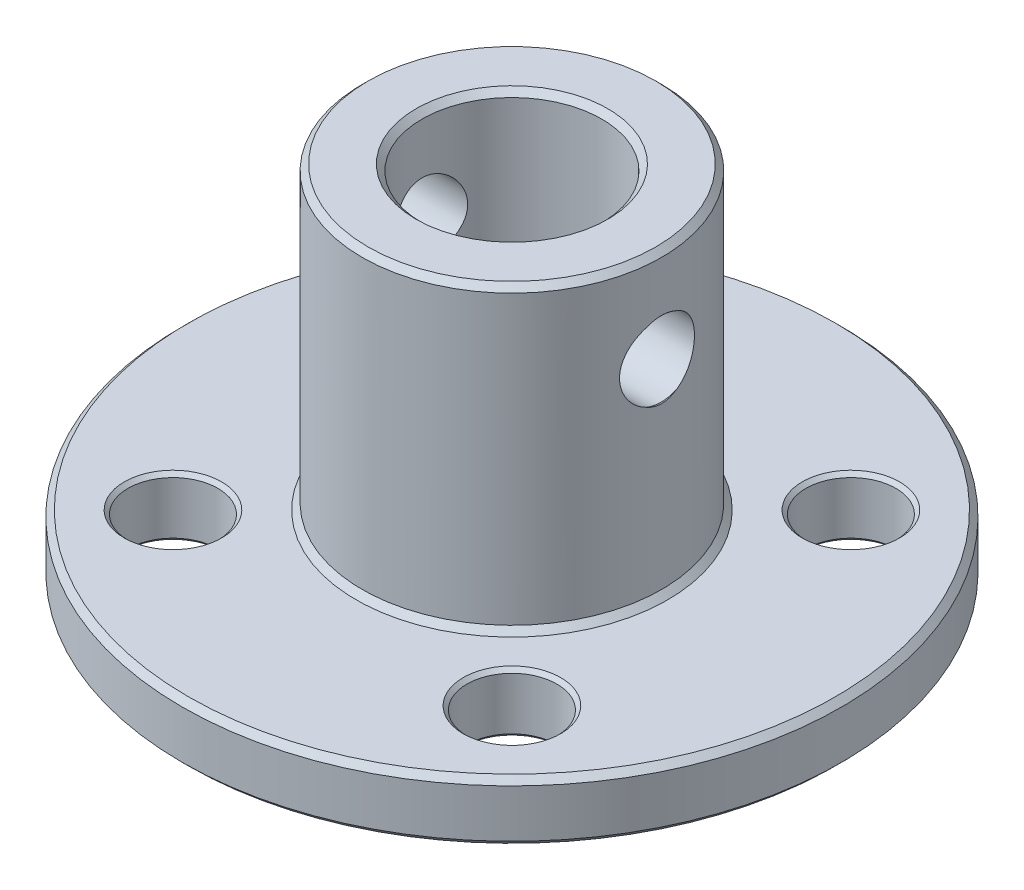
from build123d import *

# Parameters (mm, degrees)
SKETCH1_R                   = 11
FLANGE_DEPTH                = 2
SKETCH2_R                   = 5
COLLAR_DEPTH                = 10
SKETCH3_R                   = 3
CUT_EXTRUDE1_DEPTH          = 20.646882704
SET_SCREW_TAP_1_D           = 2.5
SET_SCREW_TAP_1_DEPTH       = 5
SET_SCREW_TAP_1_CSINK_D     = 2.55
SET_SCREW_TAP_1_CSINK_ANGLE = 90
SET_SCREW_TAP_2_D           = 2.5
SET_SCREW_TAP_2_DEPTH       = 8.001
SET_SCREW_TAP_2_CSINK_D     = 2.55
SET_SCREW_TAP_2_CSINK_ANGLE = 90
FLANGE_HOLES_AT_2_COUNT     = 2
FLANGE_HOLES_AT_2_PITCH     = 8
FLANGE_HOLES_AT_3_COUNT     = 2
FLANGE_HOLES_AT_3_PITCH     = 8
FLANGE_HOLES_AT_4_COUNT     = 2
FLANGE_HOLES_AT_4_PITCH     = 8
FLANGE_HOLES_AT_5_COUNT     = 2
FLANGE_HOLES_AT_5_PITCH     = 8
BODY_CHAMFERS_SIZE          = 0.2


with BuildPart() as part:
    # Sketch1 → Flange (new body)
    with BuildSketch(Plane(origin=(0, 0, 0), x_dir=(1, 0, 0), z_dir=(0, 1, 0))):
        with Locations(Location((0, 0, 0), (0, 0, 270))):
            Circle(SKETCH1_R)
    extrude(amount=FLANGE_DEPTH)

    # Sketch2 → Collar (add)
    with BuildSketch(Plane(origin=(0, 2, 0), x_dir=(1, 0, 0), z_dir=(0, 1, 0))):
        with Locations(Location((0, 0, 0), (0, 0, 270))):
            Circle(SKETCH2_R)
    extrude(amount=COLLAR_DEPTH)

    # Sketch3 → Cut-Extrude1 (cut, through all)
    with BuildSketch(Plane(origin=(0, 12, 0), x_dir=(1, 0, 0), z_dir=(0, 1, 0))):
        with Locations(Location((0, 0, 0), (0, 0, 270))):
            Circle(SKETCH3_R)
    extrude(amount=-CUT_EXTRUDE1_DEPTH, mode=Mode.SUBTRACT)

    # Set Screw Tap 1
    with Locations(Plane(origin=(5, 8.85, 0), x_dir=(0, 0, 1), z_dir=(1, 0, 0))):
        with Locations((0, 0)):
            CounterSinkHole(SET_SCREW_TAP_1_D / 2, SET_SCREW_TAP_1_CSINK_D / 2, depth=SET_SCREW_TAP_1_DEPTH, counter_sink_angle=SET_SCREW_TAP_1_CSINK_ANGLE)

    # Set Screw Tap 2
    with Locations(Plane(origin=(-5, 8.85, 0), x_dir=(0, 0, -1), z_dir=(-1, 0, 0))):
        with Locations((0, 0)):
            CounterSinkHole(SET_SCREW_TAP_2_D / 2, SET_SCREW_TAP_2_CSINK_D / 2, depth=SET_SCREW_TAP_2_DEPTH, counter_sink_angle=SET_SCREW_TAP_2_CSINK_ANGLE)

    # Sketch11 → Flange Holes (revolve, cut)
    with BuildSketch(Plane(origin=(0, 2, 0), x_dir=(0, 0, 1), z_dir=(1, 0, 0))):
        Polygon((0, 0), (0, 2), (1.625, 2), (1.5, 1.875), (1.5, 0.125), (1.625, 0), align=None)
    flange_holes = revolve(axis=Axis((0, 8.35, 0), (0, -1, 0)), mode=Mode.SUBTRACT)

    # Flange Holes at 2: Flange Holes ×2
    with Locations(*[Vector(-0.7071067811865476, 0, -0.7071067811865476) * (i * FLANGE_HOLES_AT_2_PITCH) for i in range(1, FLANGE_HOLES_AT_2_COUNT)]):
        add(flange_holes, mode=Mode.SUBTRACT)

    # Flange Holes at 3: Flange Holes ×2
    with Locations(*[Vector(-0.7071067811865476, 0, 0.7071067811865476) * (i * FLANGE_HOLES_AT_3_PITCH) for i in range(1, FLANGE_HOLES_AT_3_COUNT)]):
        add(flange_holes, mode=Mode.SUBTRACT)

    # Flange Holes at 4: Flange Holes ×2
    with Locations(*[Vector(0.7071067811865476, 0, 0.7071067811865476) * (i * FLANGE_HOLES_AT_4_PITCH) for i in range(1, FLANGE_HOLES_AT_4_COUNT)]):
        add(flange_holes, mode=Mode.SUBTRACT)

    # Flange Holes at 5: Flange Holes ×2
    with Locations(*[Vector(0.7071067811865476, 0, -0.7071067811865476) * (i * FLANGE_HOLES_AT_5_PITCH) for i in range(1, FLANGE_HOLES_AT_5_COUNT)]):
        add(flange_holes, mode=Mode.SUBTRACT)

    # Body Chamfers
    body_chamfers_edges = [part.edges().sort_by_distance(p)[0] for p in [
        (0, 0, -3),
        (0, 12, -3),
        (0, 0, -11),
        (0, 2, -11),
        (0, 2, -5),
        (0, 12, -5),
    ]]
    chamfer(body_chamfers_edges, length=BODY_CHAMFERS_SIZE)


solid = part.part
